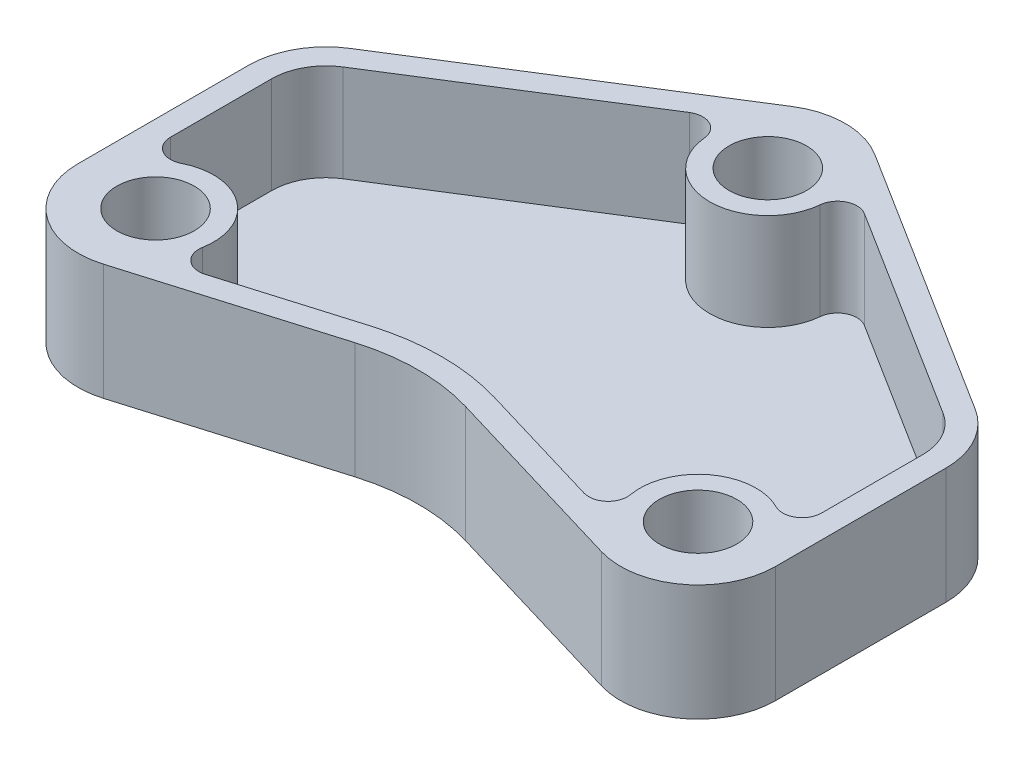
from build123d import *

# Parameters (mm, degrees)
SKETCH1_R           = 10
BOSS_EXTRUDE1_DEPTH = 30
CUT_EXTRUDE1_DEPTH  = 25
FILLET1_R           = 5


with BuildPart() as part:
    # Sketch1 → Boss-Extrude1 (new body)
    with BuildSketch(Plane(origin=(0, 0, 0), x_dir=(1, 0, 0), z_dir=(0, 1, 0))):
        with BuildLine():
            Line((-90, 0), (-90, 43.954606061))
            ThreePointArc((-90, 43.954606061), (-87.507512185, 53.62347451), (-80.651298291, 60.88238928))
            Line((-80.651298291, 60.88238928), (-10.651298291, 104.927783219))
            ThreePointArc((-10.651298291, 104.927783219), (0, 108), (10.651298291, 104.927783219))
            Line((10.651298291, 104.927783219), (80.651298291, 60.88238928))
            ThreePointArc((80.651298291, 60.88238928), (87.507512185, 53.62347451), (90, 43.954606061))
            Line((90, 43.954606061), (90, 0))
            ThreePointArc((90, 0), (81.952286093, -16.035674515), (64.285714286, -19.16629695))
            Line((64.285714286, -19.16629695), (14.285714286, -4.2591771))
            ThreePointArc((14.285714286, -4.2591771), (0, -2.174919475), (-14.285714286, -4.2591771))
            Line((-14.285714286, -4.2591771), (-64.285714286, -19.16629695))
            ThreePointArc((-64.285714286, -19.16629695), (-81.952286093, -16.035674515), (-90, 0))
        make_face()
        with Locations(Location((0, 88, 0), (0, 0, 270))):
            Circle(SKETCH1_R, mode=Mode.SUBTRACT)
        with Locations(Location((-70, 0, 0), (0, 0, 270))):
            Circle(SKETCH1_R, mode=Mode.SUBTRACT)
        with Locations(Location((70, 0, 0), (0, 0, 90))):
            Circle(SKETCH1_R, mode=Mode.SUBTRACT)
    extrude(amount=BOSS_EXTRUDE1_DEPTH)

    # Sketch2 → Cut-Extrude1 (cut)
    with BuildSketch(Plane(origin=(0, 30, 0), x_dir=(1, 0, 0), z_dir=(0, 1, 0))):
        with BuildLine():
            Line((-12.013853927, 96.981498418), (-77.455908804, 55.804054314))
            ThreePointArc((-77.455908804, 55.804054314), (-82.25525853, 50.722813975), (-84, 43.954606061))
            Line((-84, 43.954606061), (-84, 5.385164807))
            ThreePointArc((-84, 5.385164807), (-61.03578543, 12.026755886), (-60.839316609, -11.877789349))
            Line((-60.839316609, -11.877789349), (-16, 1.490711985))
            ThreePointArc((-16, 1.490711985), (0, 3.825080525), (16, 1.490711985))
            Line((16, 1.490711985), (60.839316609, -11.877789349))
            ThreePointArc((60.839316609, -11.877789349), (61.03578543, 12.026755886), (84, 5.385164807))
            Line((84, 5.385164807), (84, 43.954606061))
            ThreePointArc((84, 43.954606061), (82.25525853, 50.722813975), (77.455908804, 55.804054314))
            Line((77.455908804, 55.804054314), (12.013853927, 96.981498418))
            ThreePointArc((12.013853927, 96.981498418), (0, 73), (-12.013853927, 96.981498418))
        make_face()
    extrude(amount=-CUT_EXTRUDE1_DEPTH, mode=Mode.SUBTRACT)

    # Fillet1
    fillet1_edges = [part.edges().sort_by_distance(p)[0] for p in [
        (84, 17.5, -5.385164807),
        (60.839316609, 17.5, 11.877789349),
        (-60.839316609, 17.5, 11.877789349),
        (-84, 17.5, -5.385164807),
        (-12.013853927, 17.5, -96.981498418),
        (12.013853927, 17.5, -96.981498418),
    ]]
    fillet(fillet1_edges, radius=FILLET1_R)


solid = part.part
